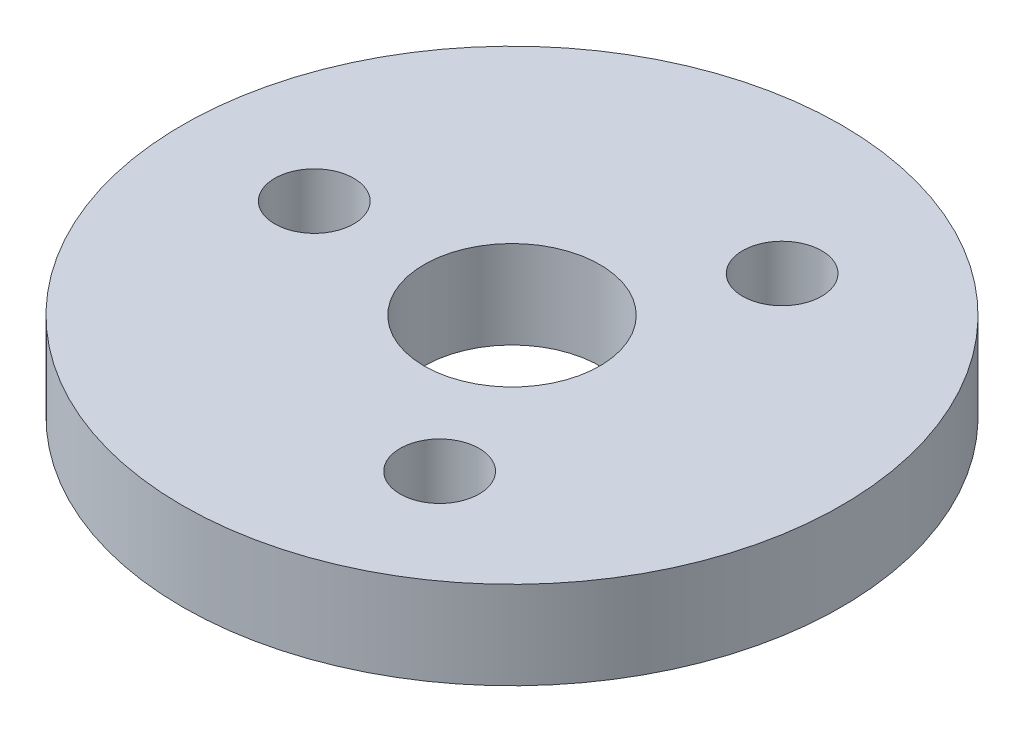
from build123d import *

# Parameters (mm, degrees)
CROQUIS1_R                       = 15
CROQUIS1_R_2                     = 4
SALIENTE_EXTRUIR1_DEPTH          = 4
TALADRO_DE_MARGEN_PARA_M31_D     = 3.6
TALADRO_DE_MARGEN_PARA_M31_DEPTH = 5
TALADRO_DE_MARGEN_PARA_M31_TIP   = 1.081549114


with BuildPart() as part:
    # Croquis1 → Saliente-Extruir1 (new body)
    with BuildSketch(Plane(origin=(0, 0, 0), x_dir=(-1, 0, 0), z_dir=(0, 1, 0))):
        with Locations(Location((0, 0, 0), (0, 0, 90))):
            Circle(CROQUIS1_R)
        with Locations(Location((0, 0, 0), (0, 0, 90))):
            Circle(CROQUIS1_R_2, mode=Mode.SUBTRACT)
    extrude(amount=SALIENTE_EXTRUIR1_DEPTH)

    # Taladro de margen para M31
    with Locations(Plane(origin=(0, 4, 0), x_dir=(-1, 0, 0), z_dir=(0, 1, 0))):
        with Locations((-4.5, 7.794228634), (9, 0), (-4.5, -7.794228634), (0, 0)):
            Hole(TALADRO_DE_MARGEN_PARA_M31_D / 2, depth=TALADRO_DE_MARGEN_PARA_M31_DEPTH)
            with Locations((0, 0, -(TALADRO_DE_MARGEN_PARA_M31_DEPTH + TALADRO_DE_MARGEN_PARA_M31_TIP / 2))):  # 118° drill point
                Cone(0, TALADRO_DE_MARGEN_PARA_M31_D / 2, TALADRO_DE_MARGEN_PARA_M31_TIP, mode=Mode.SUBTRACT)


solid = part.part
